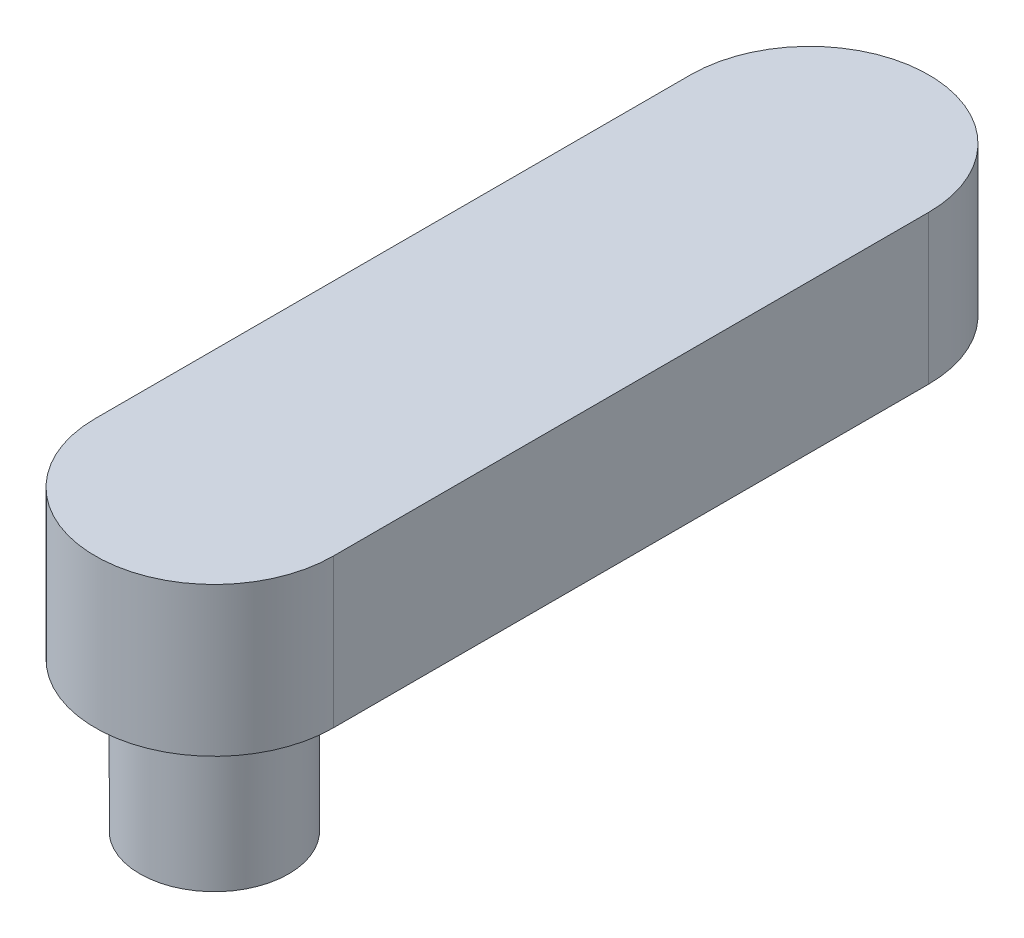
from build123d import *

# Parameters (mm, degrees)
BOSS_EXTRUDE1_DEPTH = 10
SKETCH2_R           = 5
BOSS_EXTRUDE2_DEPTH = 10


with BuildPart() as part:
    # Sketch1 → Boss-Extrude1 (new body)
    with BuildSketch(Plane(origin=(0, 0, 0), x_dir=(1, 0, 0), z_dir=(0, 1, 0))):
        with BuildLine():
            Line((8, 20), (8, -20))
            ThreePointArc((8, -20), (0, -28), (-8, -20))
            Line((-8, -20), (-8, 20))
            ThreePointArc((-8, 20), (0, 28), (8, 20))
        make_face()
    extrude(amount=BOSS_EXTRUDE1_DEPTH)

    # Sketch2 → Boss-Extrude2 (add)
    with BuildSketch(Plane.XZ):
        with Locations(Location((0, 20, 0), (0, 0, 90))):
            Circle(SKETCH2_R)
    extrude(amount=BOSS_EXTRUDE2_DEPTH)


solid = part.part
